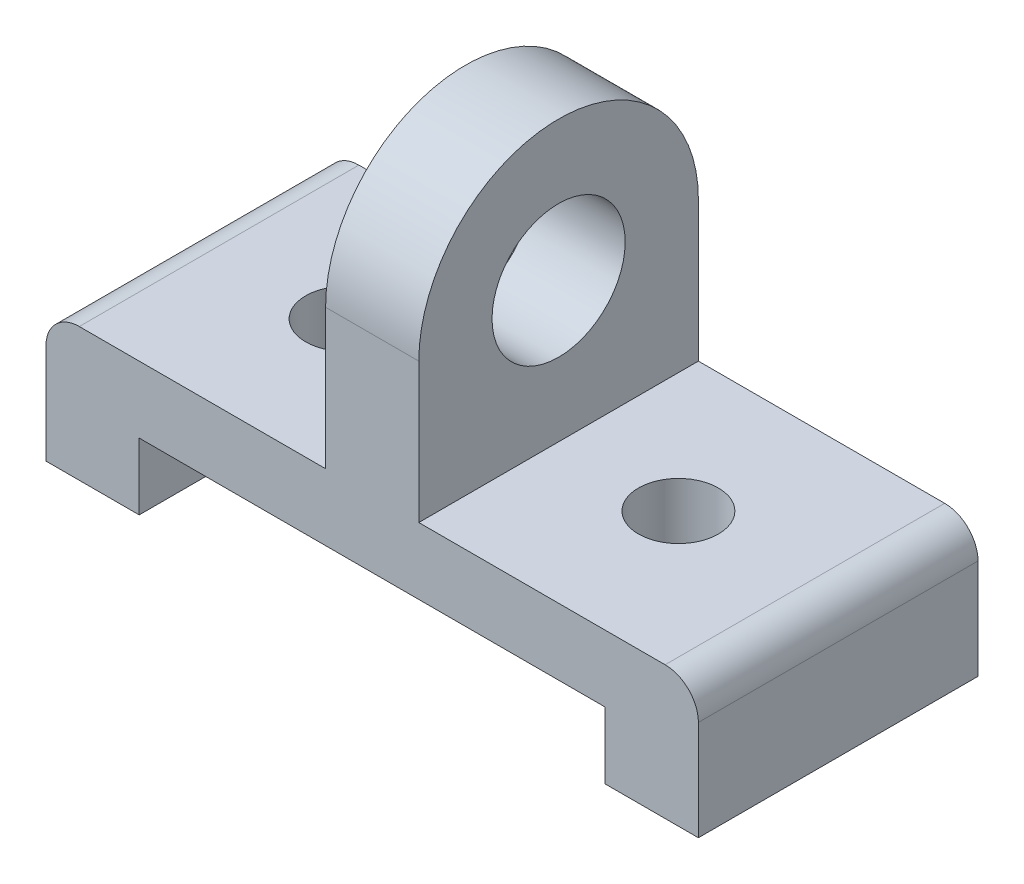
from build123d import *

# Parameters (mm, degrees)
BOSS_EXTRUDE1_DEPTH      = 10
BOSS_EXTRUDE1_DEPTH_BACK = 0.01
SKETCH1_W                = 98
SKETCH1_H                = 42
SKETCH1_R                = 6
FILLET1_R                = 5
FILLET2_R                = 5
SKETCH3_W                = 14
SKETCH3_H                = 42
BOSS_EXTRUDE4_DEPTH      = 10
SKETCH10_W               = 14
SKETCH10_H               = 42
BOSS_EXTRUDE5_DEPTH      = 10
SKETCH11_W               = 14
SKETCH11_H               = 42
BOSS_EXTRUDE6_DEPTH      = 42
FILLET3_RADIUS           = 21
FILLET3_LENGTH           = 14
CUT_EXTRUDE1_DEPTH       = 80.252760204
CUT_EXTRUDE1_DEPTH_BACK  = 80.252760204
SKETCH12_R               = 10


with BuildPart() as part:
    # Sketch1 → Boss-Extrude1 (new, two sides: drawn at the far end of the back side and taken through both)
    with BuildSketch(Plane(origin=(0, 0, 0), x_dir=(1, 0, 0), z_dir=(0, 1, 0)).offset(-BOSS_EXTRUDE1_DEPTH_BACK)):
        Rectangle(SKETCH1_W, SKETCH1_H)
        with Locations(Location((25, 0, 0), (0, 0, 270))):
            Circle(SKETCH1_R, mode=Mode.SUBTRACT)
        with Locations(Location((-25, 0, 0), (0, 0, 270))):
            Circle(SKETCH1_R, mode=Mode.SUBTRACT)
    extrude(amount=BOSS_EXTRUDE1_DEPTH + BOSS_EXTRUDE1_DEPTH_BACK)

    # Fillet1
    fillet1_edges = [part.edges().sort_by_distance(p)[0] for p in [
        (-49, 10, 0),
    ]]
    fillet(fillet1_edges, radius=FILLET1_R)

    # Fillet2
    fillet2_edges = [part.edges().sort_by_distance(p)[0] for p in [
        (49, 10, 0),
    ]]
    fillet(fillet2_edges, radius=FILLET2_R)

    # Sketch3 → Boss-Extrude4 (add)
    with BuildSketch(Plane.XZ.offset(0.01)):
        with Locations((-42, 0)):
            Rectangle(SKETCH3_W, SKETCH3_H)
    extrude(amount=BOSS_EXTRUDE4_DEPTH)

    # Sketch10 → Boss-Extrude5 (add)
    with BuildSketch(Plane.XZ.offset(0.01)):
        with Locations((42, 0)):
            Rectangle(SKETCH10_W, SKETCH10_H)
    extrude(amount=BOSS_EXTRUDE5_DEPTH)

    # Sketch11 → Boss-Extrude6 (add)
    with BuildSketch(Plane(origin=(0, 10, 0), x_dir=(1, 0, 0), z_dir=(0, 1, 0))):
        Rectangle(SKETCH11_W, SKETCH11_H)
    extrude(amount=BOSS_EXTRUDE6_DEPTH)

    # Fillet3: full round fillet: the end face becomes a half cylinder, R = half its width
    fillet3_face = Plane((0, 52, 0), x_dir=(1, 0, 0), z_dir=(0, 1, 0))  # on the end face: x along it, z out of the body
    fillet3_slab = fillet3_face.offset(-FILLET3_RADIUS / 2) * Box(FILLET3_LENGTH, 2 * FILLET3_RADIUS, FILLET3_RADIUS, mode=Mode.PRIVATE)  # the body's end, R deep
    fillet3_round = Plane((0, 31, 0), x_dir=(0, 1, 0), z_dir=(1, 0, 0)) * Cylinder(FILLET3_RADIUS, FILLET3_LENGTH, mode=Mode.PRIVATE)  # its axis R under the face
    add(fillet3_slab - fillet3_round, mode=Mode.SUBTRACT)

    # Sketch12 → Cut-Extrude1 (cut, two sides: drawn at the far end of the back side and taken through both)
    with BuildSketch(Plane(origin=(7, 0, 0), x_dir=(0, 0, -1), z_dir=(1, 0, 0)).offset(-CUT_EXTRUDE1_DEPTH_BACK)):
        with Locations((0, 31)):
            Circle(SKETCH12_R)
    extrude(amount=CUT_EXTRUDE1_DEPTH + CUT_EXTRUDE1_DEPTH_BACK, mode=Mode.SUBTRACT)


solid = part.part
